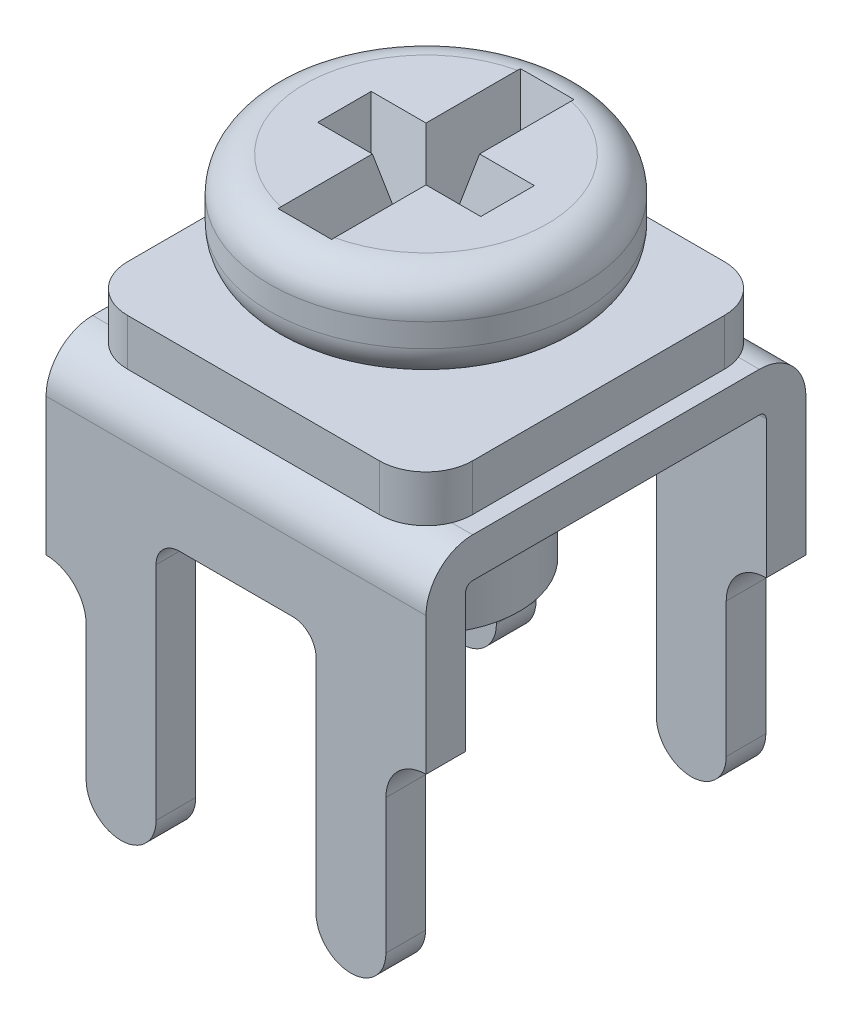
from build123d import *

# Parameters (mm, degrees)
EXTRUDE_THIN1_DEPTH               = 4.075
CUT_EXTRUDE1_DEPTH                = 8.45230669
CUT_EXTRUDE1_DEPTH_BACK           = 8.45230669
BOSS_EXTRUDE1_DEPTH               = 1
BOSS_EXTRUDE2_DEPTH               = 0.5
BOSS_EXTRUDE2_DEPTH_BACK          = 5
SKETCH5_R                         = 2
SKETCH6_R                         = 3.35
BOSS_EXTRUDE3_DEPTH               = 2
FILLET1_R                         = 0.75
SKETCH7_W                         = 1.15
SKETCH7_H                         = 5.2
CUT_EXTRUDE_THIN1_DEPTH           = 2
CUT_EXTRUDE_THIN1_DRAFT           = -13
SKETCH7_W_2                       = 3.5
SKETCH7_H_2                       = 1.15
CUT_EXTRUDE_THIN1_PROFILE_2_DEPTH = 2
CUT_EXTRUDE_THIN1_PROFILE_2_DRAFT = -13


with BuildPart() as part:
    # Sketch1 → Extrude-Thin1 (new, symmetric)
    with BuildSketch(Plane(origin=(0, 0, 0), x_dir=(0, 0, -1), z_dir=(1, 0, 0))):
        with BuildLine():
            Line((-4.075, -3.725), (-4.075, 3.725))
            ThreePointArc((-4.075, 3.725), (-3.782106781, 4.432106781), (-3.075, 4.725))
            Line((-3.075, 4.725), (3.075, 4.725))
            ThreePointArc((3.075, 4.725), (3.782106781, 4.432106781), (4.075, 3.725))
            Line((4.075, 3.725), (4.075, -3.725))
            Line((4.075, -3.725), (3.225, -3.725))
            Line((3.225, -3.725), (3.225, 3.725))
            ThreePointArc((3.225, 3.725), (3.181066017, 3.831066017), (3.075, 3.875))
            Line((3.075, 3.875), (-3.075, 3.875))
            ThreePointArc((-3.075, 3.875), (-3.181066017, 3.831066017), (-3.225, 3.725))
            Line((-3.225, 3.725), (-3.225, -3.725))
            Line((-3.225, -3.725), (-4.075, -3.725))
        make_face()
    extrude(amount=EXTRUDE_THIN1_DEPTH, both=True)

    # Sketch3 → Cut-Extrude1 (cut, two sides: drawn at the far end of the back side and taken through both)
    with BuildSketch(Plane.XY.offset(-CUT_EXTRUDE1_DEPTH_BACK)):
        with BuildLine():
            Line((-1.715, -3.725), (1.715, -3.725))
            Line((1.715, -3.725), (1.715, -3.972782835))
            Line((1.715, -3.972782835), (3.215, -3.972782835))
            Line((3.215, -3.972782835), (3.215, -3.725))
            Line((3.215, -3.725), (4.075, -3.725))
            Line((4.075, -3.725), (4.075, 0.775))
            ThreePointArc((4.075, 0.775), (3.466888168, 0.523111832), (3.215, -0.085))
            Line((3.215, -0.085), (3.215, -2.975))
            ThreePointArc((3.215, -2.975), (2.465, -3.725), (1.715, -2.975))
            Line((1.715, -2.975), (1.715, 1.775))
            ThreePointArc((1.715, 1.775), (1.568553391, 2.128553391), (1.215, 2.275))
            Line((1.215, 2.275), (-1.215, 2.275))
            ThreePointArc((-1.215, 2.275), (-1.568553391, 2.128553391), (-1.715, 1.775))
            Line((-1.715, 1.775), (-1.715, -2.975))
            ThreePointArc((-1.715, -2.975), (-2.465, -3.725), (-3.215, -2.975))
            Line((-3.215, -2.975), (-3.215, -0.085))
            ThreePointArc((-3.215, -0.085), (-3.466888168, 0.523111832), (-4.075, 0.775))
            Line((-4.075, 0.775), (-4.075, -3.725))
            Line((-4.075, -3.725), (-3.215, -3.725))
            Line((-3.215, -3.725), (-3.215, -3.972782835))
            Line((-3.215, -3.972782835), (-1.715, -3.972782835))
            Line((-1.715, -3.972782835), (-1.715, -3.725))
        make_face()
    extrude(amount=CUT_EXTRUDE1_DEPTH + CUT_EXTRUDE1_DEPTH_BACK, mode=Mode.SUBTRACT)

    # Sketch4 → Boss-Extrude1 (add)
    with BuildSketch(Plane(origin=(0, 4.725, 0), x_dir=(1, 0, 0), z_dir=(0, 1, 0))):
        with BuildLine():
            Line((-2.7, -3.7), (2.7, -3.7))
            ThreePointArc((2.7, -3.7), (3.407106781, -3.407106781), (3.7, -2.7))
            Line((3.7, -2.7), (3.7, 2.7))
            ThreePointArc((3.7, 2.7), (3.407106781, 3.407106781), (2.7, 3.7))
            Line((2.7, 3.7), (-2.7, 3.7))
            ThreePointArc((-2.7, 3.7), (-3.407106781, 3.407106781), (-3.7, 2.7))
            Line((-3.7, 2.7), (-3.7, -2.7))
            ThreePointArc((-3.7, -2.7), (-3.407106781, -3.407106781), (-2.7, -3.7))
        make_face()
    extrude(amount=BOSS_EXTRUDE1_DEPTH)

    # Sketch5 → Boss-Extrude2 (add, two sides: drawn at the far end of the back side and taken through both)
    with BuildSketch(Plane(origin=(0, 5.725, 0), x_dir=(1, 0, 0), z_dir=(0, 1, 0)).offset(-BOSS_EXTRUDE2_DEPTH_BACK)):
        with Locations(Location((0, 0, 0), (0, 0, 270))):
            Circle(SKETCH5_R)
    extrude(amount=BOSS_EXTRUDE2_DEPTH + BOSS_EXTRUDE2_DEPTH_BACK)

    # Sketch6 → Boss-Extrude3 (add)
    with BuildSketch(Plane(origin=(0, 6.225, 0), x_dir=(1, 0, 0), z_dir=(0, 1, 0))):
        with Locations(Location((0, 0, 0), (0, 0, 270))):
            Circle(SKETCH6_R)
    extrude(amount=BOSS_EXTRUDE3_DEPTH)

    # Fillet1
    fillet1_edges = [part.edges().sort_by_distance(p)[0] for p in [
        (0, 6.225, -3.35),
        (0, 8.225, -3.35),
    ]]
    fillet(fillet1_edges, radius=FILLET1_R)


with BuildPart() as cut_extrude_thin1_tool:
    # Sketch7 → Cut-Extrude-Thin1 (with draft: the straight prism first)
    with BuildSketch(Plane(origin=(0, 8.225, 0), x_dir=(1, 0, 0), z_dir=(0, 1, 0))):
        Rectangle(SKETCH7_W, SKETCH7_H)
    extrude(amount=-CUT_EXTRUDE_THIN1_DEPTH)
    # Cut-Extrude-Thin1: the draft: its side faces are tilted about the plane it starts from
    cut_extrude_thin1_sides = [cut_extrude_thin1_tool.faces().sort_by_distance(p)[0] for p in [
        (-0.575, 7.225, 0),
        (0, 7.225, 2.6),
        (0.575, 7.225, 0),
        (0, 7.225, -2.6),
    ]]
    draft(cut_extrude_thin1_sides, Plane(origin=(0, 8.225, 0), x_dir=(1, 0, 0), z_dir=(0, 1, 0)), CUT_EXTRUDE_THIN1_DRAFT)


with BuildPart() as part_1:
    add(part.part)

    # Cut-Extrude-Thin1: cut by cut_extrude_thin1_tool
    add(cut_extrude_thin1_tool.part, mode=Mode.SUBTRACT)


with BuildPart() as cut_extrude_thin1_profile_2_tool:
    # Sketch7 → Cut-Extrude-Thin1 profile 2 (with draft: the straight prism first)
    with BuildSketch(Plane(origin=(0, 8.225, 0), x_dir=(1, 0, 0), z_dir=(0, 1, 0))):
        Rectangle(SKETCH7_W_2, SKETCH7_H_2)
    extrude(amount=-CUT_EXTRUDE_THIN1_PROFILE_2_DEPTH)
    # Cut-Extrude-Thin1 profile 2: the draft: its side faces are tilted about the plane it starts from
    cut_extrude_thin1_profile_2_sides = [cut_extrude_thin1_profile_2_tool.faces().sort_by_distance(p)[0] for p in [
        (0, 7.225, -0.575),
        (-1.75, 7.225, 0),
        (0, 7.225, 0.575),
        (1.75, 7.225, 0),
    ]]
    draft(cut_extrude_thin1_profile_2_sides, Plane(origin=(0, 8.225, 0), x_dir=(1, 0, 0), z_dir=(0, 1, 0)), CUT_EXTRUDE_THIN1_PROFILE_2_DRAFT)


with BuildPart() as part_2:
    add(part_1.part)

    # Cut-Extrude-Thin1 profile 2: cut by cut_extrude_thin1_profile_2_tool
    add(cut_extrude_thin1_profile_2_tool.part, mode=Mode.SUBTRACT)


solid = part_2.part
